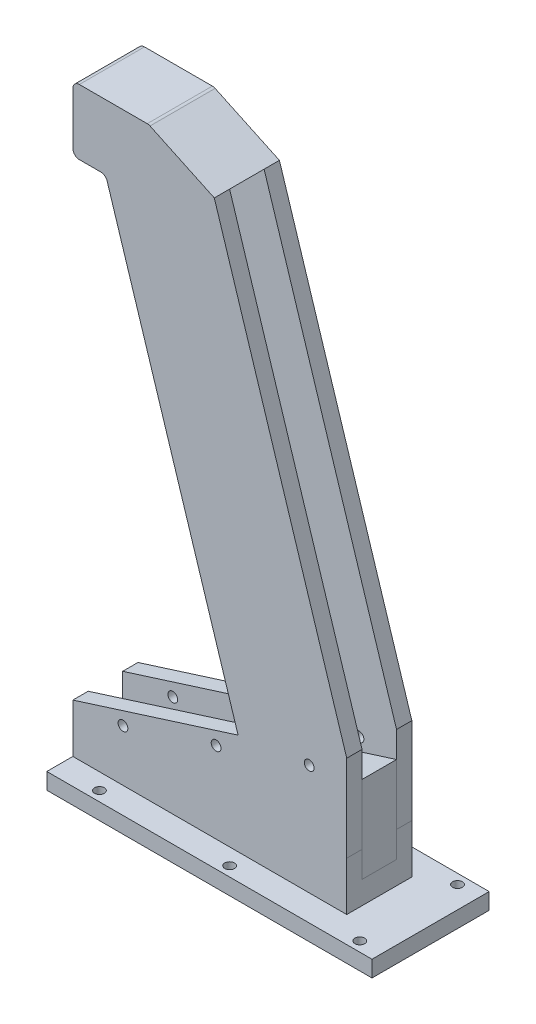
from build123d import *

# Parameters (mm, degrees)
SKETCH1_W               = 84.13774666
SKETCH1_H               = 20
BOSS_EXTRUDE1_DEPTH     = 15
SKETCH5_W               = 10.6
SKETCH5_H               = 8
CUT_EXTRUDE1_DEPTH      = 85.71
SKETCH8_W               = 109.89774666
SKETCH8_H               = 36
SKETCH8_W_2             = 84.13774666
SKETCH8_H_2             = 20
BOSS_EXTRUDE4_DEPTH     = 5
SKETCH9_R               = 1.5
SKETCH9_W               = 10
SKETCH9_H               = 18
CUT_EXTRUDE3_DEPTH      = 62.668496692
BOSS_EXTRUDE7_DEPTH     = 10.6
BOSS_EXTRUDE8_DEPTH     = 4.7
BOSS_EXTRUDE9_DEPTH     = 4.7
CUT_EXTRUDE4_DEPTH      = 75.342943395
CUT_EXTRUDE4_DEPTH_BACK = 75.342943395
SKETCH15_R              = 1.5
SKETCH28_W              = 35
SKETCH28_H              = 4.7
BOSS_EXTRUDE11_DEPTH    = 135
BOSS_EXTRUDE15_DEPTH    = 20
FILLET2_R               = 2


with BuildPart() as part:
    # Sketch1 → Boss-Extrude1 (new body)
    with BuildSketch(Plane(origin=(0, 0, 0), x_dir=(1, 0, 0), z_dir=(0, 1, 0))):
        with Locations((-0.785000002, 0)):
            Rectangle(SKETCH1_W, SKETCH1_H)
    extrude(amount=BOSS_EXTRUDE1_DEPTH)

    # Sketch5 → Cut-Extrude1 (cut)
    with BuildSketch(Plane.ZY.offset(42.853873332)):
        with Locations((0, 11)):
            Rectangle(SKETCH5_W, SKETCH5_H)
    extrude(amount=-CUT_EXTRUDE1_DEPTH, mode=Mode.SUBTRACT)

    # Sketch13 → Boss-Extrude8 (add)
    with BuildSketch(Plane.XY.offset(-5.3)):
        Polygon((41.283565473, 41.593025237), (-42.853873332, 15), (-17.542743649, 15), (41.283565473, 33.593025237), align=None)
        Polygon((41.283565473, 33.593025237), (-17.542743649, 15), (41.283565473, 15), align=None)
    extrude(amount=-BOSS_EXTRUDE8_DEPTH)

    # Sketch14 → Boss-Extrude9 (add)
    with BuildSketch(Plane(origin=(0, 0, 5.3), x_dir=(-1, 0, 0), z_dir=(0, 0, -1))):
        Polygon((42.853873332, 15), (-41.283565473, 41.593025237), (-41.283565473, 15), align=None)
    extrude(amount=-BOSS_EXTRUDE9_DEPTH)

    # Sketch15 → Cut-Extrude4 (cut, two sides: drawn at the far end of the back side and taken through both)
    with BuildSketch(Plane.XY.offset(-5.3).offset(-CUT_EXTRUDE4_DEPTH_BACK)):
        with Locations((-27.45904269, 15.865790136)):
            Circle(SKETCH15_R)
        with Locations((1.146160893, 24.906936522)):
            Circle(SKETCH15_R)
        with Locations((29.751364476, 33.948082908)):
            Circle(SKETCH15_R)
    extrude(amount=CUT_EXTRUDE4_DEPTH + CUT_EXTRUDE4_DEPTH_BACK, mode=Mode.SUBTRACT)

    # Sketch28 → Boss-Extrude11 (add)
    with BuildSketch(Plane(origin=(-8.202592071, 25.952108956, 0), x_dir=(0.9535067860990042, 0.3013715462069171, 0), z_dir=(-0.3013715462069171, 0.9535067860990042, 0))):
        with Locations((34.39911416, 7.65)):
            Rectangle(SKETCH28_W, SKETCH28_H)
        with Locations((34.39911416, -7.65)):
            Rectangle(SKETCH28_W, SKETCH28_H)
    extrude(amount=BOSS_EXTRUDE11_DEPTH)

    # Sketch31 → Boss-Extrude15 (add)
    with BuildSketch(Plane(origin=(0, 0, -10), x_dir=(-1, 0, 0), z_dir=(0, 0, -1))):
        Polygon((42.853369775, 159.768437243), (42.853369775, 179.768437243), (19.553369775, 179.768437243), (-0.598406735, 170.316441361), (32.774330778, 159.768437243), align=None)
    extrude(amount=-BOSS_EXTRUDE15_DEPTH)

    # Fillet2
    fillet2_edges = [part.edges().sort_by_distance(p)[0] for p in [
        (-32.774330778, 159.768437243, 7.65),
        (-19.553369775, 179.768437243, 0),
        (-42.853369775, 179.768437243, 0),
        (-42.853369775, 159.768437243, 0),
        (-32.774330778, 159.768437243, -7.65),
    ]]
    fillet(fillet2_edges, radius=FILLET2_R)


with BuildPart() as body_2:
    # Sketch8 → Boss-Extrude4 (new body)
    # profile 1 of 2: a face of its own
    with BuildSketch(Plane.XZ):
        with Locations((2.094999998, 0)):
            Rectangle(SKETCH8_W, SKETCH8_H)
        with Locations((-0.785000002, 0)):
            Rectangle(SKETCH8_W_2, SKETCH8_H_2, mode=Mode.SUBTRACT)
    # profile 2 of 2: a face of its own
    with BuildSketch(Plane.XZ):
        with Locations((-0.785000002, 0)):
            Rectangle(SKETCH8_W_2, SKETCH8_H_2)
    extrude(amount=BOSS_EXTRUDE4_DEPTH)

    # Sketch9 → Cut-Extrude3 (cut, through all)
    with BuildSketch(Plane(origin=(0, 0, 0), x_dir=(1, 0, 0), z_dir=(0, 1, 0))):
        with Locations(Location((-29.693873332, 15, 0), (0, 0, 270))):
            Circle(SKETCH9_R)
        with Locations(Location((10.306126668, 15, 0), (0, 0, 270))):
            Circle(SKETCH9_R)
        with Locations(Location((-29.693873332, -15, 0), (0, 0, 270))):
            Circle(SKETCH9_R)
        with Locations(Location((50.306126668, -15, 0), (0, 0, 270))):
            Circle(SKETCH9_R)
        with Locations(Location((50.306126668, 15, 0), (0, 0, 270))):
            Circle(SKETCH9_R)
        with Locations((-47.853873332, 9)):
            Rectangle(SKETCH9_W, SKETCH9_H)
        with Locations((-47.853873332, -9)):
            Rectangle(SKETCH9_W, SKETCH9_H)
        with Locations(Location((10.306126668, -15, 0), (0, 0, 270))):
            Circle(SKETCH9_R)
    extrude(amount=-CUT_EXTRUDE3_DEPTH, mode=Mode.SUBTRACT)


with BuildPart() as body_3:
    # Sketch11 → Boss-Extrude7 (new body)
    with BuildSketch(Plane.XY.offset(-5.3)):
        Polygon((41.283565473, 33.593025237), (-17.542743649, 15), (41.283565473, 15), align=None)
        Polygon((-17.542743649, 15), (-42.853873332, 7), (41.283565473, 7), (41.283565473, 15), align=None)
    extrude(amount=BOSS_EXTRUDE7_DEPTH)


solid = Compound([part.part, body_2.part, body_3.part])
